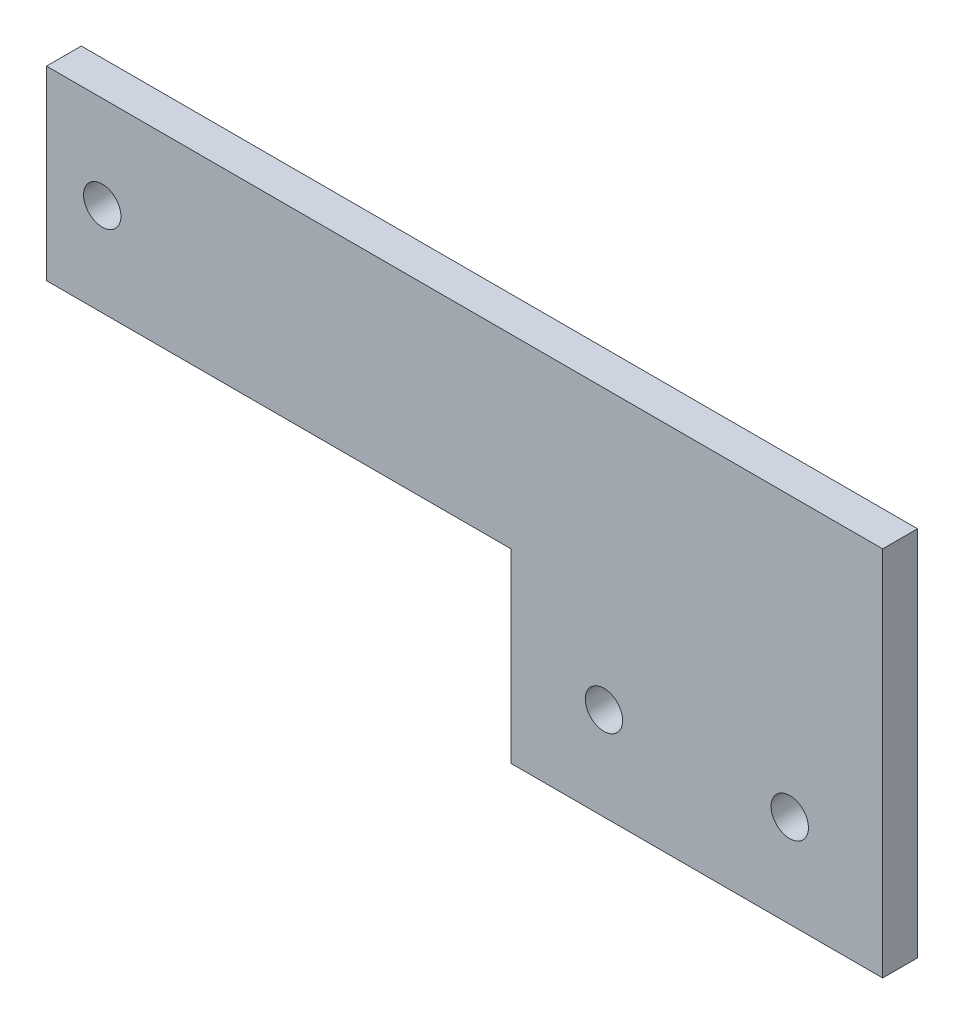
from build123d import *

# Parameters (mm, degrees)
SKETCH1_W           = 50.8
SKETCH1_H           = 50.8
SKETCH1_R           = 2.5527
SKETCH1_W_2         = 63.5
SKETCH1_H_2         = 25.4
BOSS_EXTRUDE1_DEPTH = 4.7625


with BuildPart() as part:
    # Sketch1 → Boss-Extrude1 (new body)
    # profile 1 of 2: a face of its own
    with BuildSketch(Plane.XY):
        with Locations((25.4, 25.4)):
            Rectangle(SKETCH1_W, SKETCH1_H)
        with Locations(Location((38.1, 12.7, 0), (0, 0, 180))):
            Circle(SKETCH1_R, mode=Mode.SUBTRACT)
        with Locations(Location((12.7, 12.7, 0), (0, 0, 180))):
            Circle(SKETCH1_R, mode=Mode.SUBTRACT)
    # profile 2 of 2: a face of its own
    with BuildSketch(Plane.XY):
        with Locations((-31.75, 38.1)):
            Rectangle(SKETCH1_W_2, SKETCH1_H_2)
        with Locations(Location((-55.88, 38.1, 0), (0, 0, 180))):
            Circle(SKETCH1_R, mode=Mode.SUBTRACT)
    extrude(amount=BOSS_EXTRUDE1_DEPTH)


solid = part.part
